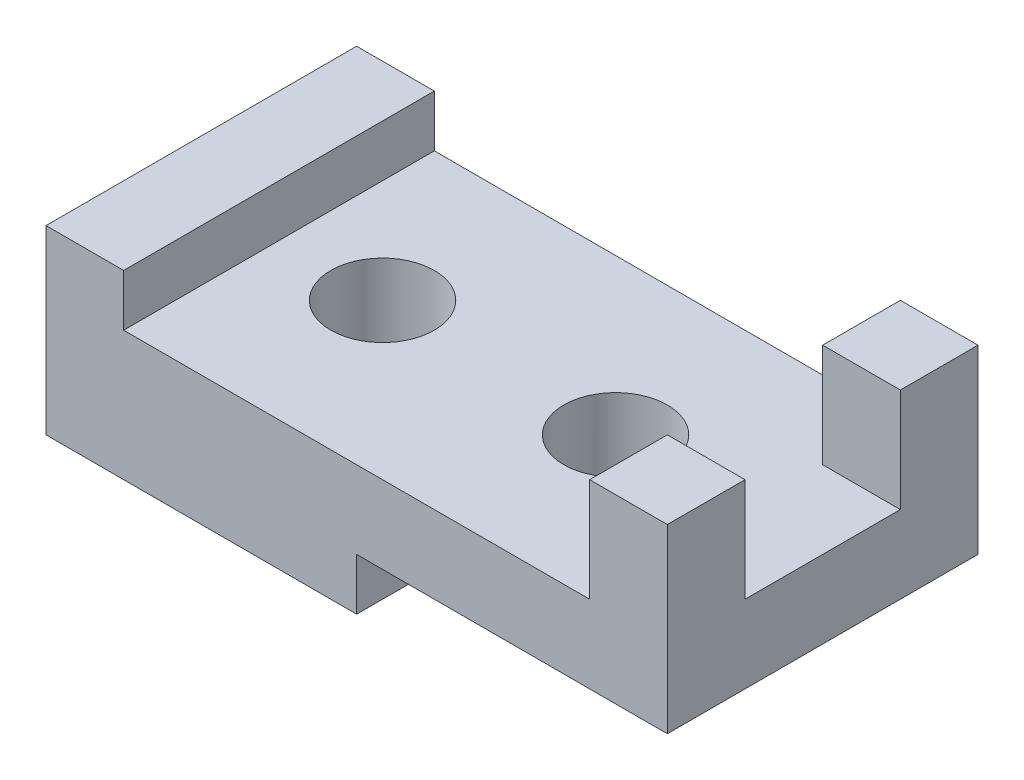
from build123d import *

# Parameters (mm, degrees)
SKETCH1_W           = 120
SKETCH1_H           = 60
BOSS_EXTRUDE1_DEPTH = 25
SKETCH2_W           = 60
SKETCH2_H           = 10
CUT_EXTRUDE1_DEPTH  = 89.459030065
SKETCH3_W           = 15
SKETCH3_H           = 60
BOSS_EXTRUDE2_DEPTH = 10
SKETCH4_W           = 15
SKETCH4_H           = 15
BOSS_EXTRUDE3_DEPTH = 20
SKETCH5_R           = 10
CUT_EXTRUDE2_DEPTH  = 72.589105316
SKETCH6_R           = 10
CUT_EXTRUDE3_DEPTH  = 72.589105316


with BuildPart() as part:
    # Sketch1 → Boss-Extrude1 (new body)
    with BuildSketch(Plane(origin=(0, 0, 0), x_dir=(1, 0, 0), z_dir=(0, 1, 0))):
        Rectangle(SKETCH1_W, SKETCH1_H)
    extrude(amount=BOSS_EXTRUDE1_DEPTH)

    # Sketch2 → Cut-Extrude1 (cut, through all)
    with BuildSketch(Plane.XY.offset(30)):
        with Locations((30, 5)):
            Rectangle(SKETCH2_W, SKETCH2_H)
    extrude(amount=-CUT_EXTRUDE1_DEPTH, mode=Mode.SUBTRACT)

    # Sketch3 → Boss-Extrude2 (add)
    with BuildSketch(Plane(origin=(0, 25, 0), x_dir=(1, 0, 0), z_dir=(0, 1, 0))):
        with Locations((-52.5, 0)):
            Rectangle(SKETCH3_W, SKETCH3_H)
    extrude(amount=BOSS_EXTRUDE2_DEPTH)

    # Sketch4 → Boss-Extrude3 (add)
    with BuildSketch(Plane(origin=(0, 25, 0), x_dir=(1, 0, 0), z_dir=(0, 1, 0))):
        with Locations((52.5, 22.5)):
            Rectangle(SKETCH4_W, SKETCH4_H)
    boss_extrude3 = extrude(amount=BOSS_EXTRUDE3_DEPTH)

    # Mirror1: Boss-Extrude3 across plane
    add(boss_extrude3.mirror(Plane.XY))

    # Sketch5 → Cut-Extrude2 (cut, through all)
    with BuildSketch(Plane(origin=(0, 25, 0), x_dir=(1, 0, 0), z_dir=(0, 1, 0))):
        with Locations(Location((-25, 0, 0), (0, 0, 270))):
            Circle(SKETCH5_R)
    extrude(amount=-CUT_EXTRUDE2_DEPTH, mode=Mode.SUBTRACT)

    # Sketch6 → Cut-Extrude3 (cut, through all)
    with BuildSketch(Plane(origin=(0, 25, 0), x_dir=(1, 0, 0), z_dir=(0, 1, 0))):
        with Locations(Location((20, 0, 0), (0, 0, 270))):
            Circle(SKETCH6_R)
    extrude(amount=-CUT_EXTRUDE3_DEPTH, mode=Mode.SUBTRACT)


solid = part.part
